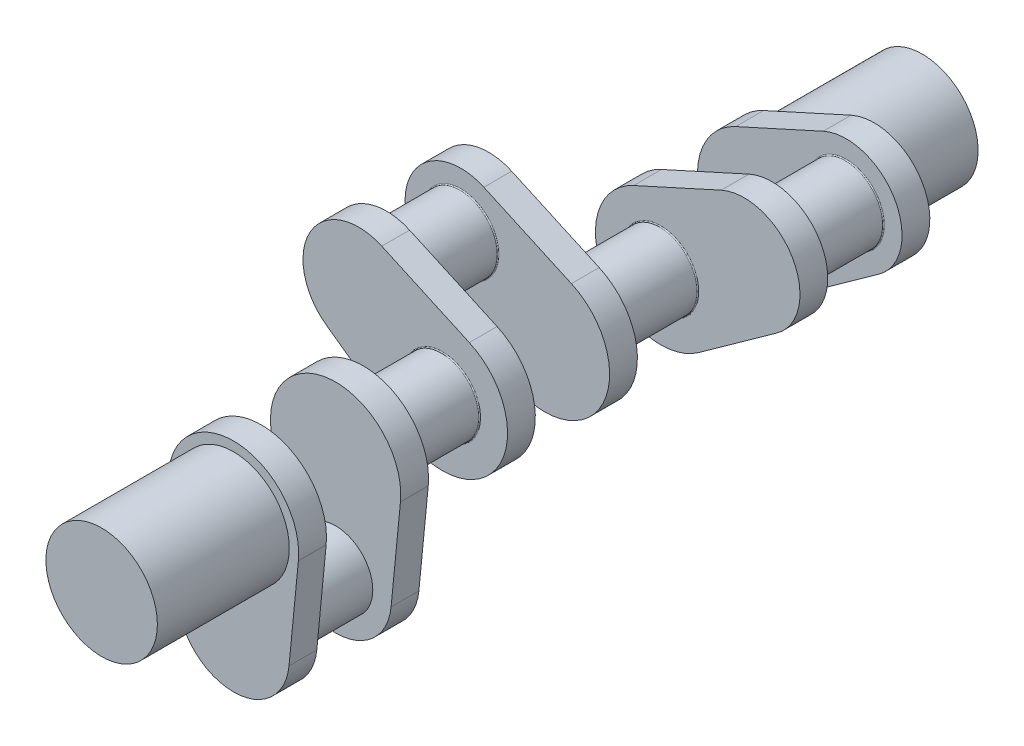
from build123d import *

# Parameters (mm, degrees)
BOSS_EXTRUDE1_DEPTH  = 19
SKETCH2_R            = 25.4
BOSS_EXTRUDE2_DEPTH  = 50.78
SKETCH3_R            = 25.4
BOSS_EXTRUDE3_DEPTH  = 53.985
BOSS_EXTRUDE5_DEPTH  = 19
SKETCH7_R            = 25.4
BOSS_EXTRUDE7_DEPTH  = 50.78
SKETCH8_R            = 25.4
BOSS_EXTRUDE8_DEPTH  = 60.38
BOSS_EXTRUDE9_DEPTH  = 19
SKETCH10_R           = 25.4
BOSS_EXTRUDE10_DEPTH = 50.78
SKETCH11_R           = 38.1
BOSS_EXTRUDE11_DEPTH = 90.17
BOSS_EXTRUDE12_START = 90.17
SKETCH12_R           = 38.1
BOSS_EXTRUDE12_DEPTH = 90.17
FILLET1_R            = 0.64


with BuildPart() as part:
    # Sketch1 → Boss-Extrude1 (new body)
    with BuildSketch(Plane.XY):
        with BuildLine():
            Line((-44.318296914, -4.336987277), (-37.918866212, -69.73073917))
            ThreePointArc((-37.918866212, -69.73073917), (0, -104.12), (37.918866212, -69.73073917))
            Line((37.918866212, -69.73073917), (44.318296914, -4.336987277))
            ThreePointArc((44.318296914, -4.336987277), (0, 44.53), (-44.318296914, -4.336987277))
        make_face()
    boss_extrude1 = extrude(amount=-BOSS_EXTRUDE1_DEPTH)

    # Sketch2 → Boss-Extrude2 (add)
    with BuildSketch(Plane(origin=(0, 0, -19), x_dir=(-1, 0, 0), z_dir=(0, 0, -1))):
        with Locations(Location((0, -66.02, 0), (0, 0, 180))):
            Circle(SKETCH2_R)
    extrude(amount=BOSS_EXTRUDE2_DEPTH)

    # Mirror1: Boss-Extrude1 across plane
    add(boss_extrude1.mirror(Plane(origin=(0, 0, -44.39), x_dir=(1, 0, 0), z_dir=(0, 0, -1))))

    # Sketch3 → Boss-Extrude3 (add)
    with BuildSketch(Plane(origin=(0, 0, -88.78), x_dir=(-1, 0, 0), z_dir=(0, 0, -1))):
        with Locations(Location((0, 0, 0), (0, 0, 180))):
            Circle(SKETCH3_R)
    extrude(amount=BOSS_EXTRUDE3_DEPTH)

    # Sketch6 → Boss-Extrude5 (add)
    with BuildSketch(Plane(origin=(0, 0, -142.765), x_dir=(-1, 0, 0), z_dir=(0, 0, -1))):
        with BuildLine():
            Line((25.915089614, -36.212277342), (79.348024652, 2.026668163))
            ThreePointArc((79.348024652, 2.026668163), (90.170565042, 52.06), (41.42915844, 67.704071007))
            Line((41.42915844, 67.704071007), (-18.4032073, 40.549264618))
            ThreePointArc((-18.4032073, 40.549264618), (-38.564111231, -22.265), (25.915089614, -36.212277342))
        make_face()
    boss_extrude5 = extrude(amount=BOSS_EXTRUDE5_DEPTH)

    # Sketch7 → Boss-Extrude7 (add)
    with BuildSketch(Plane(origin=(0, 0, -161.765), x_dir=(-1, 0, 0), z_dir=(0, 0, -1))):
        with Locations((57.174997158, 33.01)):
            Circle(SKETCH7_R)
    extrude(amount=BOSS_EXTRUDE7_DEPTH)

    # Mirror3: Boss-Extrude5 across plane
    add(boss_extrude5.mirror(Plane(origin=(0, 0, -187.155), x_dir=(1, 0, 0), z_dir=(0, 0, -1))))

    # Sketch8 → Boss-Extrude8 (add)
    with BuildSketch(Plane(origin=(0, 0, -231.545), x_dir=(-1, 0, 0), z_dir=(0, 0, -1))):
        with Locations(Location((0, 0, 0), (0, 0, 180))):
            Circle(SKETCH8_R)
    extrude(amount=BOSS_EXTRUDE8_DEPTH)

    # Sketch9 → Boss-Extrude9 (add)
    with BuildSketch(Plane(origin=(0, 0, -291.925), x_dir=(-1, 0, 0), z_dir=(0, 0, -1))):
        with BuildLine():
            Line((18.4032073, 40.549264618), (-41.42915844, 67.704071007))
            ThreePointArc((-41.42915844, 67.704071007), (-90.170565042, 52.06), (-79.348024652, 2.026668163))
            Line((-79.348024652, 2.026668163), (-25.915089614, -36.212277342))
            ThreePointArc((-25.915089614, -36.212277342), (38.564111231, -22.265), (18.4032073, 40.549264618))
        make_face()
    boss_extrude9 = extrude(amount=BOSS_EXTRUDE9_DEPTH)

    # Sketch10 → Boss-Extrude10 (add)
    with BuildSketch(Plane(origin=(0, 0, -310.925), x_dir=(-1, 0, 0), z_dir=(0, 0, -1))):
        with Locations((-57.174997158, 33.01)):
            Circle(SKETCH10_R)
    extrude(amount=BOSS_EXTRUDE10_DEPTH)

    # Mirror4: Boss-Extrude9 across plane
    add(boss_extrude9.mirror(Plane(origin=(0, 0, -336.315), x_dir=(1, 0, 0), z_dir=(0, 0, -1))))

    # Sketch11 → Boss-Extrude11 (add)
    with BuildSketch(Plane(origin=(0, 0, -380.705), x_dir=(-1, 0, 0), z_dir=(0, 0, -1))):
        Circle(SKETCH11_R)
    extrude(amount=BOSS_EXTRUDE11_DEPTH)

    # Sketch12 → Boss-Extrude12 (add)
    with BuildSketch(Plane.XY.offset(BOSS_EXTRUDE12_START)):
        with Locations(Location((0, 0, 0), (0, 0, 180))):
            Circle(SKETCH12_R)
    extrude(amount=-BOSS_EXTRUDE12_DEPTH)

    # Fillet1
    fillet1_edges = [part.edges().sort_by_distance(p)[0] for p in [
        (-25.4, -66.02, -19),
        (-25.4, 0, -88.78),
        (-25.4, 0, -142.765),
        (-31.774997158, 33.01, -161.765),
        (-31.774997158, 33.01, -212.545),
        (-25.4, 0, -231.545),
        (-25.4, 0, -291.925),
        (82.574997158, 33.01, -310.925),
        (82.574997158, 33.01, -361.705),
    ]]
    fillet(fillet1_edges, radius=FILLET1_R)


solid = part.part
